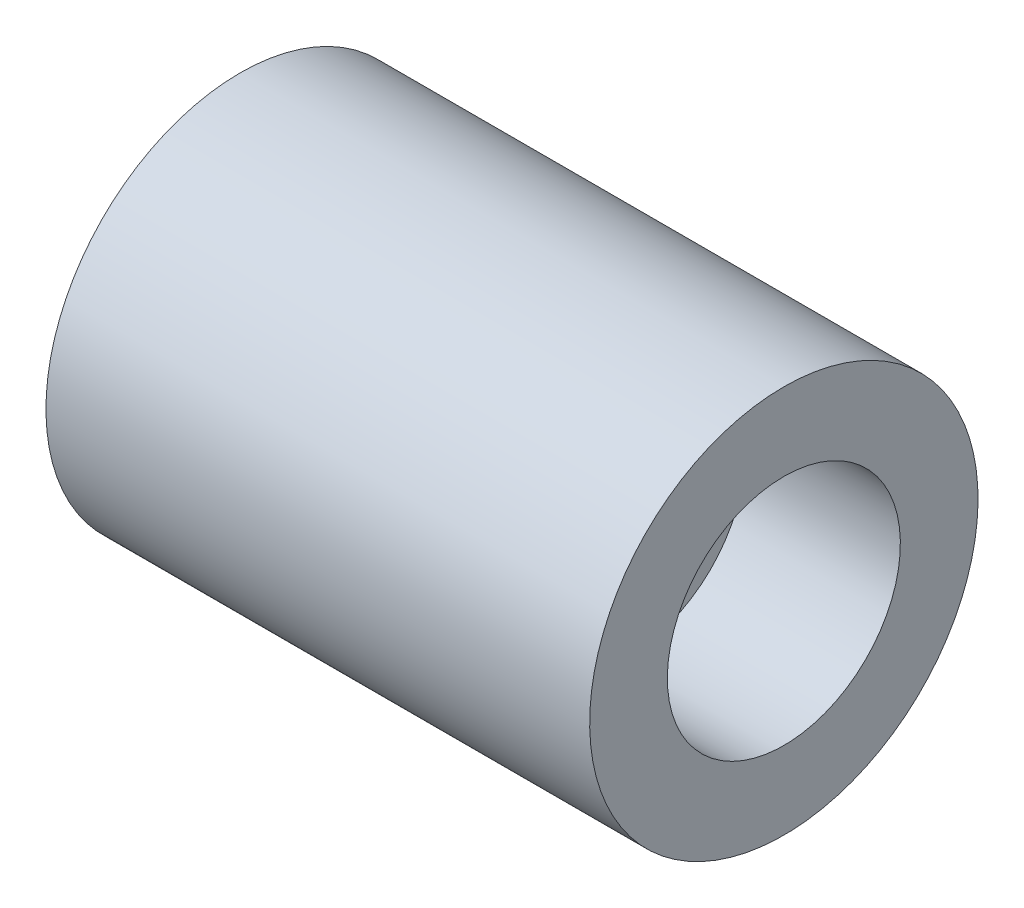
from build123d import *


with BuildPart() as part:
    # Croquis1 → Revolución1 (revolve)
    with BuildSketch(Plane.XY):
        Polygon((0, 0), (0, 50), (140, 50), (140, 30), (100, 30), (100, 10), (20, 10), (20, 0), align=None)
    revolve(axis=Axis((20, 0, 0), (-1, 0, 0)))


solid = part.part
